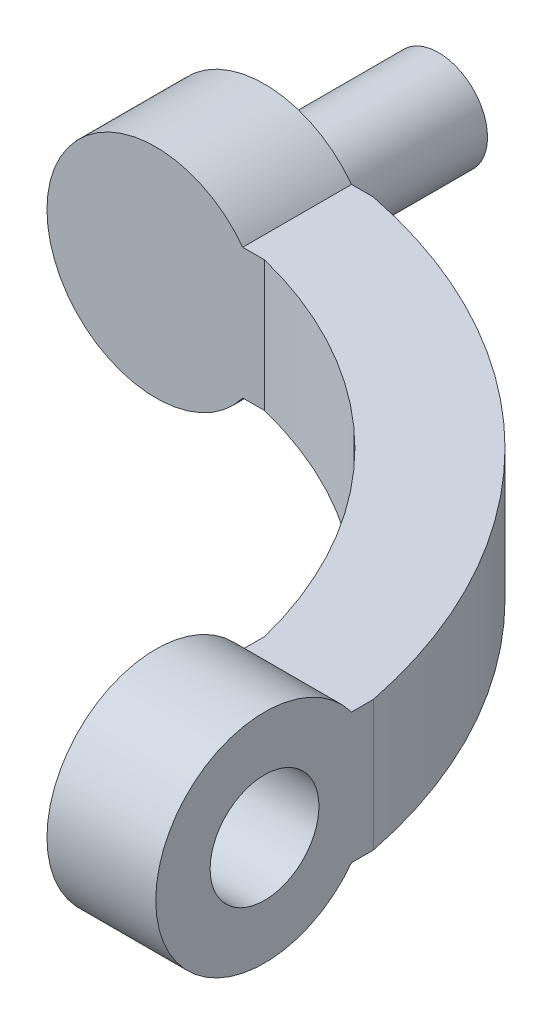
from build123d import *

# Parameters (mm, degrees)
SKETCH_2_R           = 5
EXTRUDE_3_DEPTH      = 5
EXTRUDE_4_DEPTH      = 3
EXTRUDE_4_DEPTH_BACK = 3
SKETCH_3_3_W         = 5
SKETCH_3_3_H         = 5
SKETCH_4_W           = 5
SKETCH_4_H           = 6
EXTRUDE_5_DEPTH      = 3
SKETCH_5_W           = 5
SKETCH_5_H           = 6
EXTRUDE_6_DEPTH      = 3
SKETCH_6_R           = 2.5
CUT_EXTRUDE_1_DEPTH  = 5
EXTRUDE_START        = -5
SKETCH_7_R           = 2.25
EXTRUDE_7_DEPTH      = 8


with BuildPart() as part:
    # 草图2 → 凸台-拉伸3 (new body)
    with BuildSketch(Plane.XY):
        Circle(SKETCH_2_R)
    extrude(amount=EXTRUDE_3_DEPTH)



with BuildPart() as body_2:
    # 草图3 → 凸台-拉伸4 (new, two sides: drawn at the far end of the back side and taken through both)
    with BuildSketch(Plane(origin=(0, 0, 0), x_dir=(1, 0, 0), z_dir=(0, 1, 0)).offset(-EXTRUDE_4_DEPTH_BACK)):
        with BuildLine():
            ThreePointArc((5, 0), (18.027756377, -6.972243623), (25, -20))
            Line((25, -20), (20, -20))
            ThreePointArc((20, -20), (14.577379737, -10.422620263), (5, -5))
            Line((5, -5), (5, 0))
        make_face()
    extrude(amount=EXTRUDE_4_DEPTH + EXTRUDE_4_DEPTH_BACK)



with BuildPart() as body_3:
    # 草图3<3> → 旋转1 (revolve)
    with BuildSketch(Plane(origin=(0, 0, 0), x_dir=(1, 0, 0), z_dir=(0, 1, 0)), mode=Mode.PRIVATE) as revolve_1_sk:
        with Locations((22.5, -22.5)):
            Rectangle(SKETCH_3_3_W, SKETCH_3_3_H)
    revolve(revolve_1_sk.sketch.rotate(Axis((0, 0, 25), (1, 0, 0)), 180), axis=Axis((0, 0, 25), (1, 0, 0)))


with BuildPart() as body_2_1:
    add(body_2.part)

    add(body_3.part)  # 凸台-拉伸5 merges body 3
    # 草图4 → 凸台-拉伸5 (add)
    with BuildSketch(Plane.XY.offset(20)):
        with Locations((22.5, 0)):
            Rectangle(SKETCH_4_W, SKETCH_4_H)
    extrude(amount=EXTRUDE_5_DEPTH)


with BuildPart() as part_1:
    add(part.part)

    add(body_2_1.part)  # 凸台-拉伸6 merges body 2
    # 草图5 → 凸台-拉伸6 (add)
    with BuildSketch(Plane.ZY.offset(-5)):
        with Locations((2.5, 0)):
            Rectangle(SKETCH_5_W, SKETCH_5_H)
    extrude(amount=EXTRUDE_6_DEPTH)

    # 草图6 → 切除-拉伸1 (cut)
    with BuildSketch(Plane.ZY.offset(-20)):
        with Locations((25, 0)):
            Circle(SKETCH_6_R)
    extrude(amount=-CUT_EXTRUDE_1_DEPTH, mode=Mode.SUBTRACT)

    # 草图7 → 凸台-拉伸7 (add)
    with BuildSketch(Plane.XY.offset(5).offset(EXTRUDE_START)):
        Circle(SKETCH_7_R)
    extrude(amount=-EXTRUDE_7_DEPTH)


solid = part_1.part
